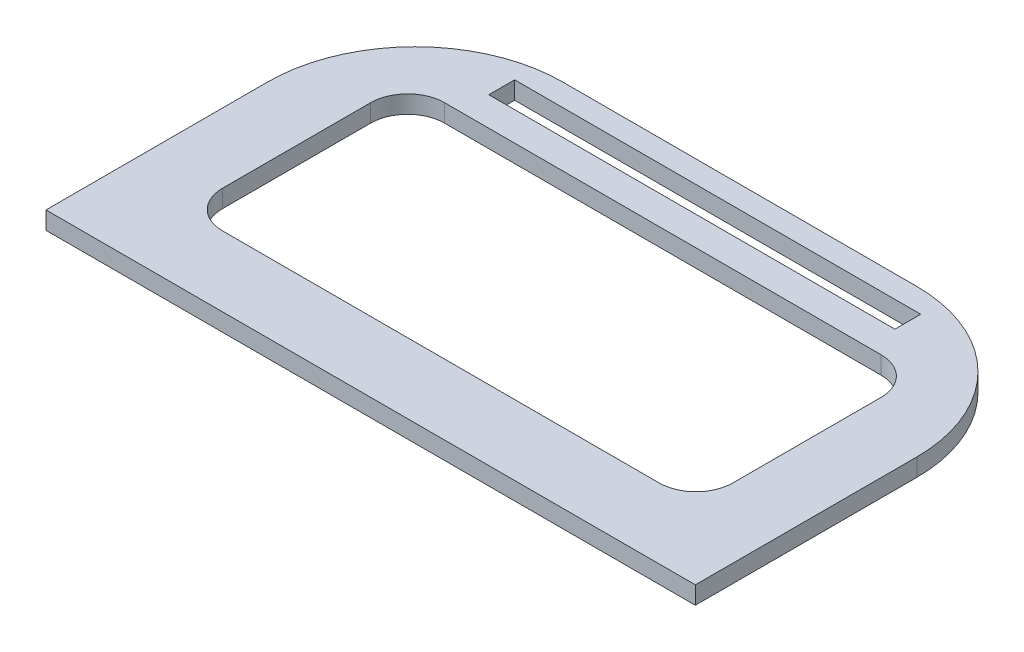
from build123d import *

# Parameters (mm, degrees)
SKETCH1_W           = 8.795086316
SKETCH1_H           = 5
SKETCH1_W_2         = 5.5
SKETCH1_H_2         = 0.35
BOSS_EXTRUDE1_DEPTH = 0.24
FILLET1_R           = 2
SKETCH2_W           = 6.913332482
SKETCH2_H           = 3.007207861
CUT_EXTRUDE1_DEPTH  = 11.119839095
FILLET4_R           = 0.5


with BuildPart() as part:
    # Sketch1 → Boss-Extrude1 (new body)
    with BuildSketch(Plane(origin=(0, 0, 0), x_dir=(1, 0, 0), z_dir=(0, 1, 0))):
        with Locations((4.397543158, 2.5)):
            Rectangle(SKETCH1_W, SKETCH1_H)
        with Locations((4.397543158, 4.525)):
            Rectangle(SKETCH1_W_2, SKETCH1_H_2, mode=Mode.SUBTRACT)
    extrude(amount=BOSS_EXTRUDE1_DEPTH)

    # Fillet1
    fillet1_edges = [part.edges().sort_by_distance(p)[0] for p in [
        (0, 0.12, -5),
        (8.795086316, 0.12, -5),
    ]]
    fillet(fillet1_edges, radius=FILLET1_R)

    # Sketch2 → Cut-Extrude1 (cut, through all)
    with BuildSketch(Plane(origin=(0, 0.24, 0), x_dir=(1, 0, 0), z_dir=(0, 1, 0))):
        with Locations((4.397543158, 2.453300335)):
            Rectangle(SKETCH2_W, SKETCH2_H)
    extrude(amount=-CUT_EXTRUDE1_DEPTH, mode=Mode.SUBTRACT)

    # Fillet4
    fillet4_edges = [part.edges().sort_by_distance(p)[0] for p in [
        (0.940876917, 0.12, -0.949696404),
        (0.940876917, 0.12, -3.956904265),
        (7.854209399, 0.12, -3.956904265),
        (7.854209399, 0.12, -0.949696404),
    ]]
    fillet(fillet4_edges, radius=FILLET4_R)


solid = part.part
